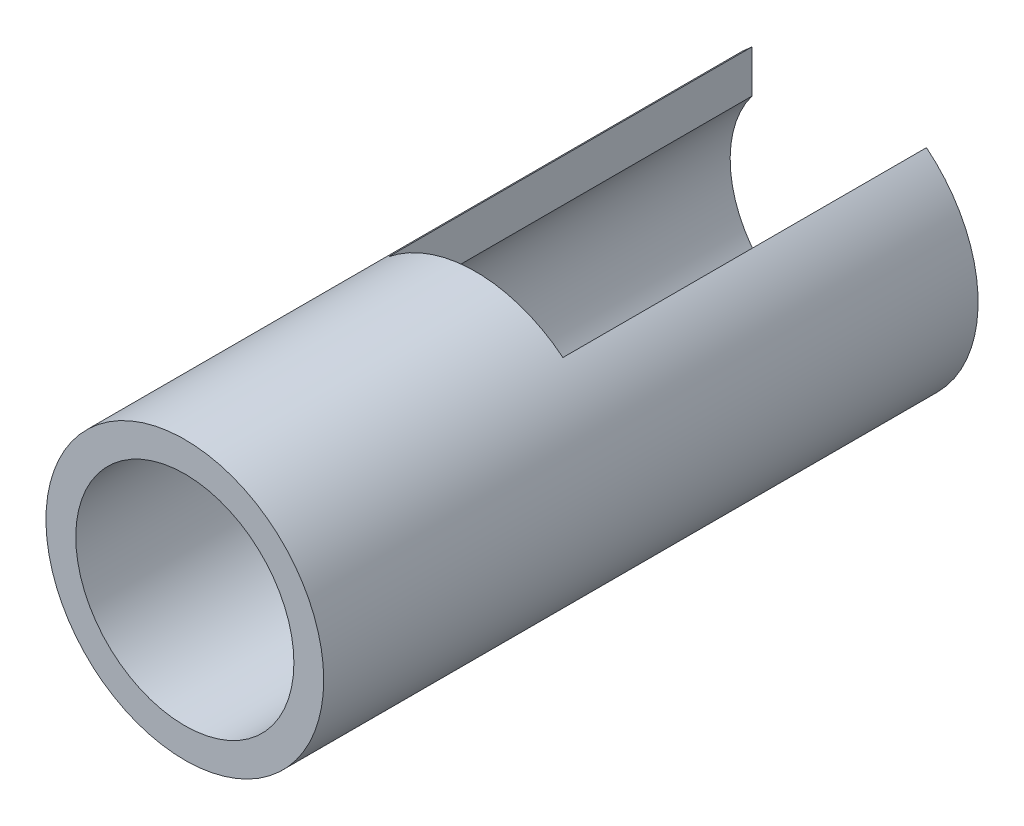
from build123d import *

# Parameters (mm, degrees)
SKETCH1_R               = 24.257
SKETCH1_R_2             = 19.05
BOSS_EXTRUDE1_DEPTH     = 114.3
CUT_EXTRUDE1_DEPTH      = 120.336893281
CUT_EXTRUDE1_DEPTH_BACK = 2.54
SKETCH2_W               = 30.48
SKETCH2_H               = 63.5


with BuildPart() as part:
    # Sketch1 → Boss-Extrude1 (new body)
    with BuildSketch(Plane.XY):
        Circle(SKETCH1_R)
        Circle(SKETCH1_R_2, mode=Mode.SUBTRACT)
    extrude(amount=BOSS_EXTRUDE1_DEPTH)

    # Sketch2 → Cut-Extrude1 (cut, two sides: drawn at the far end of the back side and taken through both)
    with BuildSketch(Plane(origin=(0, 0, 0), x_dir=(1, 0, 0), z_dir=(0, 1, 0)).offset(-CUT_EXTRUDE1_DEPTH_BACK)):
        with Locations((0, -31.75)):
            Rectangle(SKETCH2_W, SKETCH2_H)
    extrude(amount=CUT_EXTRUDE1_DEPTH + CUT_EXTRUDE1_DEPTH_BACK, mode=Mode.SUBTRACT)


solid = part.part
